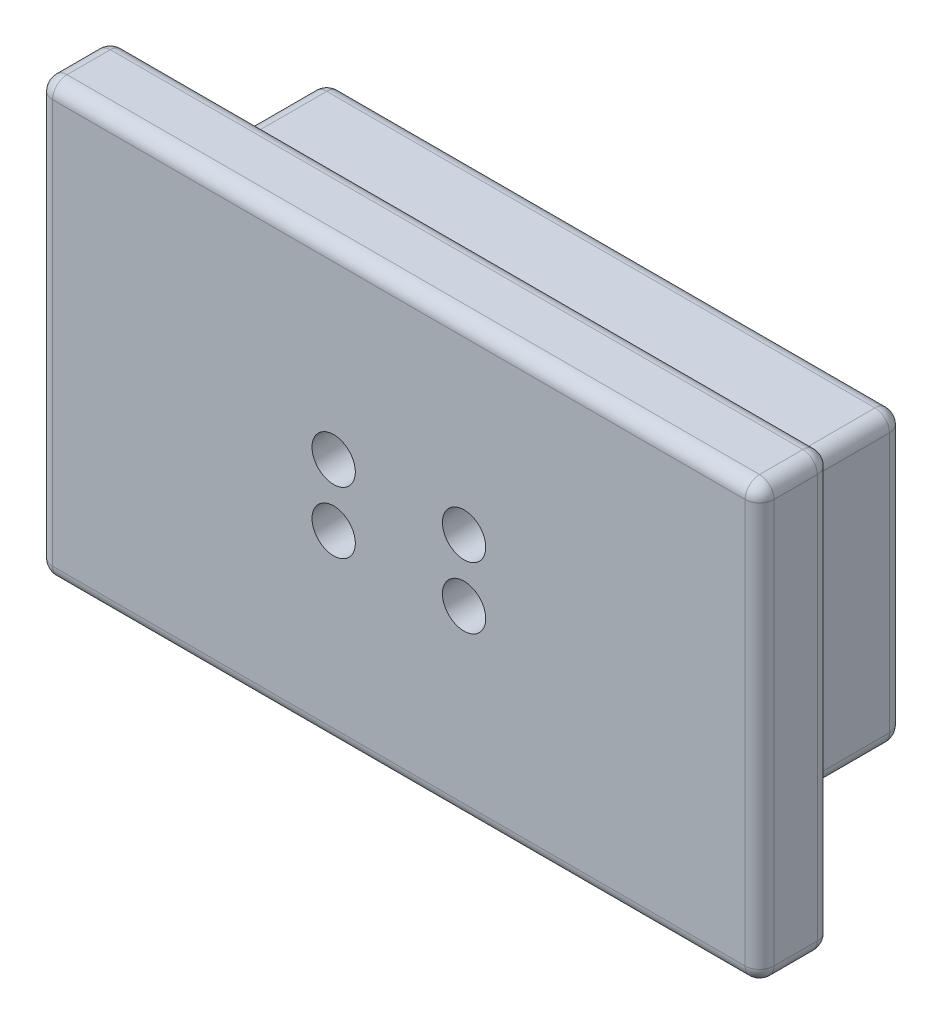
from build123d import *

# Parameters (mm, degrees)
SKETCH_1_W          = 40
SKETCH_1_H          = 20
EXTRUDE_1_DEPTH     = 10
SKETCH_2_W          = 50
SKETCH_2_H          = 30
EXTRUDE_2_DEPTH     = 5
FILLET_1_R          = 1
SKETCH_3_R          = 1.5
CUT_EXTRUDE_1_DEPTH = 33.787192622


with BuildPart() as part:
    # 草图1 → 凸台-拉伸1 (new body)
    with BuildSketch(Plane.XY):
        Rectangle(SKETCH_1_W, SKETCH_1_H)
    extrude(amount=EXTRUDE_1_DEPTH)

    # 草图2 → 凸台-拉伸2 (add)
    with BuildSketch(Plane.XY.offset(10)):
        Rectangle(SKETCH_2_W, SKETCH_2_H)
    extrude(amount=EXTRUDE_2_DEPTH)

    # 圆角1
    fillet_1_edges = [part.edges().sort_by_distance(p)[0] for p in [
        (-20, 0, 10),
        (0, -10, 10),
        (25, 0, 10),
        (25, -15, 12.5),
        (0, 15, 10),
        (25, 15, 12.5),
        (-25, 0, 10),
        (-25, 15, 12.5),
        (0, -15, 10),
        (-25, -15, 12.5),
        (25, 0, 15),
        (0, 15, 15),
        (-25, 0, 15),
        (0, -15, 15),
        (20, 0, 10),
        (0, -10, 0),
        (-20, 0, 0),
        (0, 10, 0),
        (20, 0, 0),
        (0, 10, 10),
        (20, -10, 5),
        (-20, -10, 5),
        (-20, 10, 5),
        (20, 10, 5),
    ]]
    fillet(fillet_1_edges, radius=FILLET_1_R)

    # 草图3 → 切除-拉伸1 (cut, through all)
    with BuildSketch(Plane(origin=(0, 0, 0), x_dir=(-1, 0, 0), z_dir=(0, 0, -1))):
        with Locations((-4.518689194, -2.140431724)):
            Circle(SKETCH_3_R)
        with Locations((4.518689194, 2.140431724)):
            Circle(SKETCH_3_R)
        with Locations((-4.518689194, 2.140431724)):
            Circle(SKETCH_3_R)
        with Locations((4.518689194, -2.140431724)):
            Circle(SKETCH_3_R)
    extrude(amount=-CUT_EXTRUDE_1_DEPTH, mode=Mode.SUBTRACT)


solid = part.part
